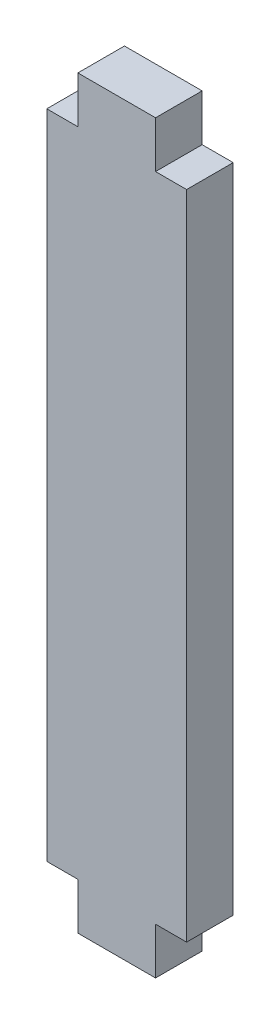
from build123d import *

# Parameters (mm, degrees)
SKETCH1_W           = 9
SKETCH1_H           = 41.95
SKETCH1_W_2         = 5
SKETCH1_H_2         = 3
BOSS_EXTRUDE1_DEPTH = 3


with BuildPart() as part:
    # Sketch1 → Boss-Extrude1 (new body)
    with BuildSketch(Plane.XY):
        Rectangle(SKETCH1_W, SKETCH1_H)
        with Locations((0, -22.475)):
            Rectangle(SKETCH1_W_2, SKETCH1_H_2)
        with Locations((0, 22.475)):
            Rectangle(SKETCH1_W_2, SKETCH1_H_2)
    extrude(amount=BOSS_EXTRUDE1_DEPTH)


solid = part.part
